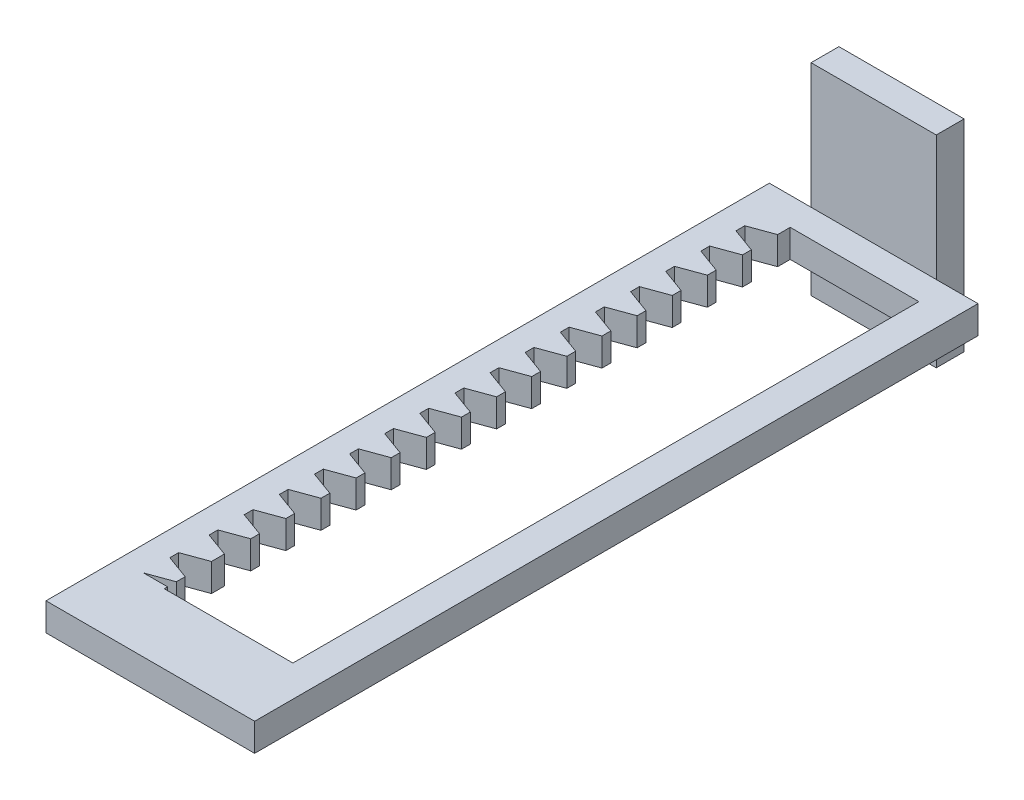
from build123d import *

# Parameters (mm, degrees)
CROQUIS1_W              = 29
CROQUIS1_H              = 18
SALIENTE_EXTRUIR1_DEPTH = 4
CROQUIS2_W              = 6
CROQUIS2_H              = 4
CROQUIS2_W_2            = 9
SALIENTE_EXTRUIR3_DEPTH = 4
CROQUIS4_W              = 4.5
CROQUIS4_H              = 4
SALIENTE_EXTRUIR4_DEPTH = 100
CROQUIS5_W              = 7
CROQUIS5_H              = 4
SALIENTE_EXTRUIR5_DEPTH = 100
CROQUIS6_W              = 30
CROQUIS6_H              = 4
SALIENTE_EXTRUIR6_DEPTH = 10
CORTAR_EXTRUIR2_DEPTH   = 10
CORTAR_EXTRUIR3_DEPTH   = 10
CORTAR_EXTRUIR4_DEPTH   = 10
CORTAR_EXTRUIR5_DEPTH   = 10


with BuildPart() as part:
    # Croquis1 → Saliente-Extruir1 (new body)
    with BuildSketch(Plane(origin=(0, 0, 0), x_dir=(0, 1, 0), z_dir=(0, 0, 1))):
        Rectangle(CROQUIS1_W, CROQUIS1_H)
    extrude(amount=SALIENTE_EXTRUIR1_DEPTH)

    # Croquis2 → Saliente-Extruir3 (add)
    with BuildSketch(Plane.XY.offset(4)):
        with Locations((-12, -5.5)):
            Rectangle(CROQUIS2_W, CROQUIS2_H)
        with Locations((-4.5, -5.5)):
            Rectangle(CROQUIS2_W_2, CROQUIS2_H)
        with Locations((4.5, -5.5)):
            Rectangle(CROQUIS2_W_2, CROQUIS2_H)
        with Locations((12, -5.5)):
            Rectangle(CROQUIS2_W, CROQUIS2_H)
    extrude(amount=SALIENTE_EXTRUIR3_DEPTH)

    # Croquis4 → Saliente-Extruir4 (add)
    with BuildSketch(Plane.XY.offset(8)):
        with Locations((12.75, -5.5)):
            Rectangle(CROQUIS4_W, CROQUIS4_H)
    extrude(amount=SALIENTE_EXTRUIR4_DEPTH)

    # Croquis5 → Saliente-Extruir5 (add)
    with BuildSketch(Plane.XY.offset(8)):
        with Locations((-11.5, -5.5)):
            Rectangle(CROQUIS5_W, CROQUIS5_H)
    extrude(amount=SALIENTE_EXTRUIR5_DEPTH)

    # Croquis6 → Saliente-Extruir6 (add)
    with BuildSketch(Plane.XY.offset(108)):
        with Locations((0, -5.5)):
            Rectangle(CROQUIS6_W, CROQUIS6_H)
    extrude(amount=-SALIENTE_EXTRUIR6_DEPTH)

    # Croquis7 → Cortar-Extruir2 (cut)
    with BuildSketch(Plane.XZ.offset(7.5)):
        Polygon((-8, 96.258476268), (-8, 97.519571135), (-11.46482967, 97.519571135), align=None)
    extrude(amount=-CORTAR_EXTRUIR2_DEPTH, mode=Mode.SUBTRACT)

    # Croquis8 → Cortar-Extruir3 (cut)
    with BuildSketch(Plane(origin=(0, -7.5, 0), x_dir=(-1, 0, 0), z_dir=(0, -1, 0))):
        Polygon((8, -94.994476268), (11.46482967, -93.733381401), (8, -93.733381401), align=None)
    extrude(amount=-CORTAR_EXTRUIR3_DEPTH, mode=Mode.SUBTRACT)

    # Croquis9 → Cortar-Extruir4 (cut)
    with BuildSketch(Plane(origin=(0, -7.5, 0), x_dir=(-1, 0, 0), z_dir=(0, -1, 0))):
        Polygon((11.46482967, -93.733381401), (11.46482967, -92.469381401), (8, -91.208286534), (8, -93.733381401), align=None)
    extrude(amount=-CORTAR_EXTRUIR4_DEPTH, mode=Mode.SUBTRACT)

    # Croquis10 → Cortar-Extruir5 (cut)
    with BuildSketch(Plane(origin=(0, -3.5, 0), x_dir=(-1, 0, 0), z_dir=(0, 1, 0))):
        Polygon((11.46482967, 11.070269037), (8, 9.80917417), (8, 13.595363904), (11.46482967, 12.334269037), align=None)
        Polygon((11.46482967, 88.087115043), (8, 89.348209909), (8, 85.562020176), (11.46482967, 86.823115043), align=None)
        Polygon((8, 84.298020176), (11.46482967, 83.036925309), (11.46482967, 81.772925309), (8, 80.511830442), align=None)
        Polygon((8, 79.247830442), (11.46482967, 77.986735575), (11.46482967, 76.722735575), (8, 75.461640708), align=None)
        Polygon((8, 70.411450974), (8, 74.197640708), (11.46482967, 72.936545841), (11.46482967, 71.672545841), align=None)
        Polygon((8, 65.361261241), (8, 69.147450974), (11.46482967, 67.886356108), (11.46482967, 66.622356108), align=None)
        Polygon((8, 60.311071507), (8, 64.097261241), (11.46482967, 62.836166374), (11.46482967, 61.572166374), align=None)
        Polygon((8, 55.260881773), (8, 59.047071507), (11.46482967, 57.78597664), (11.46482967, 56.52197664), align=None)
        Polygon((8, 50.21069204), (8, 53.996881773), (11.46482967, 52.735786906), (11.46482967, 51.471786906), align=None)
        Polygon((8, 45.160502306), (8, 48.94669204), (11.46482967, 47.685597173), (11.46482967, 46.421597173), align=None)
        Polygon((8, 43.896502306), (11.46482967, 42.635407439), (11.46482967, 41.371407439), (8, 40.110312572), align=None)
        Polygon((8, 38.846312572), (8, 35.060122838), (11.46482967, 36.321217705), (11.46482967, 37.585217705), align=None)
        Polygon((8, 33.796122838), (8, 30.009933105), (11.46482967, 31.271027972), (11.46482967, 32.535027972), align=None)
        Polygon((8, 24.959743371), (8, 28.745933105), (11.46482967, 27.484838238), (11.46482967, 26.220838238), align=None)
        Polygon((8, 23.695743371), (8, 19.909553637), (11.46482967, 21.170648504), (11.46482967, 22.434648504), align=None)
        Polygon((8, 14.859363904), (8, 18.645553637), (11.46482967, 17.38445877), (11.46482967, 16.12045877), align=None)
    extrude(amount=-CORTAR_EXTRUIR5_DEPTH, mode=Mode.SUBTRACT)


solid = part.part
